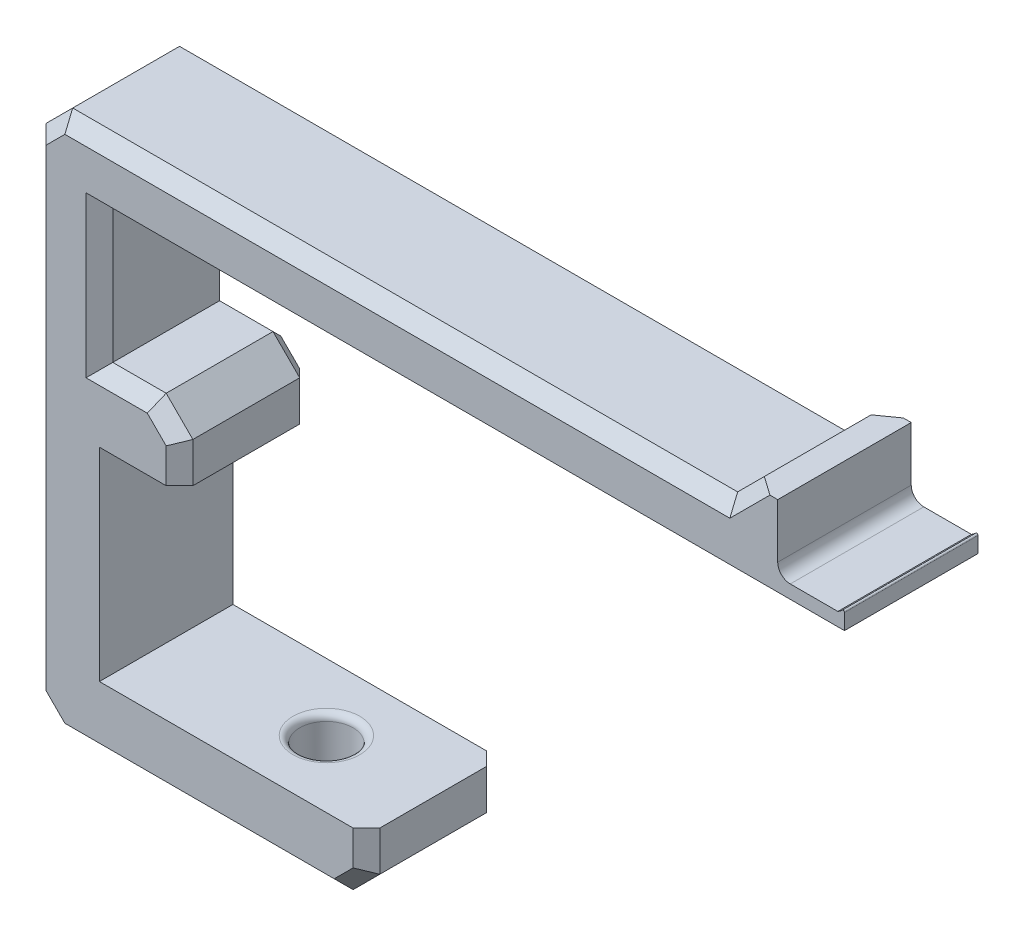
from build123d import *

# Parameters (mm, degrees)
RESSALTO_EXTRUS_O1_DEPTH = 10
ESBO_O3_R                = 2
CORTE_EXTRUS_O1_DEPTH    = 15
CHANFRO1_SIZE            = 1.6
FILETE1_R                = 0.5
FILETE2_R                = 0.94
RESSALTO_EXTRUS_O3_DEPTH = 10
CHANFRO5_SIZE            = 2
CHANFRO4_SIZE            = 1


with BuildPart() as part:
    # Esboço1 → Ressalto-extrusão1 (new body)
    with BuildSketch(Plane.XY):
        with BuildLine():
            Line((57, 14.25), (1.2, 14.25))
            Line((1.2, 14.25), (1.2, 4.25))
            Line((1.2, 4.25), (7.2, 4.25))
            Line((7.2, 4.25), (7.2, -0.75))
            Line((7.2, -0.75), (1.2, -0.75))
            Line((1.2, -0.75), (1.2, -15.95))
            Line((1.2, -15.95), (21.2, -15.95))
            Line((21.2, -15.95), (21.2, -20.95))
            Line((21.2, -20.95), (-3.8, -20.95))
            Line((-3.8, -20.95), (-3.8, 19.25))
            Line((-3.8, 19.25), (52, 19.25))
            Line((52, 19.25), (52, 16.25))
            Line((52, 16.25), (56.504380809, 16.25))
            ThreePointArc((56.504380809, 16.25), (56.67525574, 16.362291088), (56.829148206, 16.496918869))
            ThreePointArc((56.829148206, 16.496918869), (56.938176044, 16.51877572), (57, 16.426349589))
            Line((57, 16.426349589), (57, 16.25))
            Line((57, 16.25), (57, 14.25))
        make_face()
    extrude(amount=RESSALTO_EXTRUS_O1_DEPTH)

    # Esboço3 → Corte-extrusão1 (cut)
    with BuildSketch(Plane.XZ.offset(20.95)):
        with Locations(Location((13.2, 5, 0), (0, 0, 270))):
            Circle(ESBO_O3_R)
    extrude(amount=-CORTE_EXTRUS_O1_DEPTH, mode=Mode.SUBTRACT)

    # Chanfro1
    chanfro1_edges = [part.edges().sort_by_distance(p)[0] for p in [
        (13.2, -20.95, 7),
    ]]
    chamfer(chanfro1_edges, length=CHANFRO1_SIZE)

    # Filete1
    filete1_edges = [part.edges().sort_by_distance(p)[0] for p in [
        (13.2, -15.95, 7),
    ]]
    fillet(filete1_edges, radius=FILETE1_R)

    # Filete2
    filete2_edges = [part.edges().sort_by_distance(p)[0] for p in [
        (52, 16.25, 5),
    ]]
    fillet(filete2_edges, radius=FILETE2_R)

    # Esboço5 → Ressalto-extrusão3 (add)
    with BuildSketch(Plane.XY.offset(10)):
        Polygon((52, 19.25), (52, 21.25), (50, 21.25), (48, 19.25), align=None)
    extrude(amount=-RESSALTO_EXTRUS_O3_DEPTH)

    # Chanfro5
    chanfro5_edges = [part.edges().sort_by_distance(p)[0] for p in [
        (21.2, -20.95, 5),
        (-3.8, -20.95, 5),
        (-3.8, 19.25, 5),
        (7.2, 4.25, 5),
    ]]
    chamfer(chanfro5_edges, length=CHANFRO5_SIZE)

    # Chanfro4
    chanfro4_edges = [part.edges().sort_by_distance(p)[0] for p in [
        (1.2, 9.25, 10),
        (29.1, 14.25, 10),
        (29.1, 14.25, 0),
        (1.2, 9.25, 0),
        (7.2, 0.75, 0),
        (57, 14.25, 5),
        (7.2, 0.75, 10),
        (23.1, 19.25, 0),
        (23.1, 19.25, 10),
        (49, 20.25, 10),
        (49, 20.25, 0),
        (8.7, -20.95, 0),
        (8.7, -20.95, 10),
        (21.2, -17.45, 0),
        (-3.8, -0.85, 0),
        (3.2, 4.25, 0),
        (-2.8, 18.25, 0),
        (6.2, 3.25, 0),
        (20.2, -19.95, 0),
        (-2.8, -19.95, 0),
        (-3.8, -0.85, 10),
        (3.2, 4.25, 10),
        (21.2, -17.45, 10),
        (-2.8, 18.25, 10),
        (6.2, 3.25, 10),
        (20.2, -19.95, 10),
        (-2.8, -19.95, 10),
    ]]
    chamfer(chanfro4_edges, length=CHANFRO4_SIZE)


solid = part.part
